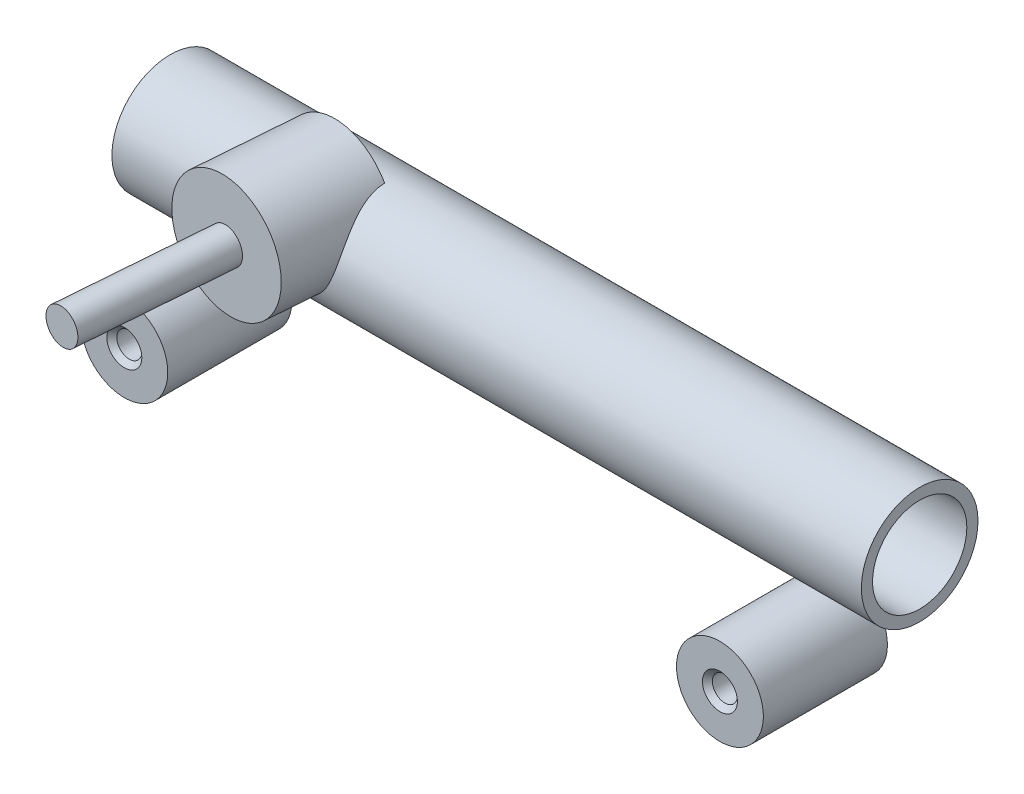
from build123d import *

# Parameters (mm, degrees)
SZKIC1_R                    = 23.5
DODANIE_WYCI_GNI_CIE1_DEPTH = 302
SZKIC2_R                    = 17.5
DODANIE_WYCI_GNI_CIE2_DEPTH = 50
SZKIC4_R                    = 17.5
DODANIE_WYCI_GNI_CIE3_DEPTH = 50
SZKIC5_R                    = 5.05
WYTNIJ_WYCI_GNI_CIE1_DEPTH  = 50
SFAZOWANIE1_SIZE            = 2
SZKIC8_R                    = 24
DODANIE_WYCI_GNI_CIE4_DEPTH = 42.129872
SZKIC12_R                   = 7
DODANIE_WYCI_GNI_CIE5_DEPTH = 61.69017
SZKIC6_R                    = 19
WYTNIJ_WYCI_GNI_CIE2_DEPTH  = 302
DODANIE_WYCI_GNI_CIE6_START = -50
SZKIC13_R                   = 7
DODANIE_WYCI_GNI_CIE6_DEPTH = 50


with BuildPart() as part:
    # Szkic1 → Dodanie-wyciągnięcie1 (new body)
    with BuildSketch(Plane(origin=(0, 0, 0), x_dir=(0, 0, -1), z_dir=(1, 0, 0))):
        Circle(SZKIC1_R)
    extrude(amount=DODANIE_WYCI_GNI_CIE1_DEPTH)

    # Szkic2 → Dodanie-wyciągnięcie2 (add)
    with BuildSketch(Plane.XY):
        with Locations(Location((31.5, -38, 0), (0, 0, 124.04773237))):
            Circle(SZKIC2_R)
    extrude(amount=DODANIE_WYCI_GNI_CIE2_DEPTH)

    # Szkic4 → Dodanie-wyciągnięcie3 (add)
    with BuildSketch(Plane(origin=(0, 0, 0), x_dir=(-1, 0, 0), z_dir=(0, 0, -1))):
        with Locations((-271.5, -38)):
            Circle(SZKIC4_R)
    extrude(amount=-DODANIE_WYCI_GNI_CIE3_DEPTH)

    # Szkic5 → Wytnij-wyciągnięcie1 (cut)
    with BuildSketch(Plane.XY.offset(50)):
        with Locations((31.5, -38)):
            Circle(SZKIC5_R)
        with Locations((271.5, -38)):
            Circle(SZKIC5_R)
    extrude(amount=-WYTNIJ_WYCI_GNI_CIE1_DEPTH, mode=Mode.SUBTRACT)

    # Sfazowanie1
    sfazowanie1_edges = [part.edges().sort_by_distance(p)[0] for p in [
        (26.45, -38, 0),
        (26.45, -38, 50),
        (266.45, -38, 0),
        (266.45, -38, 50),
    ]]
    chamfer(sfazowanie1_edges, length=SFAZOWANIE1_SIZE)

    # Szkic8 → Dodanie-wyciągnięcie4 (add)
    with BuildSketch(Plane(origin=(64.694528313, 23.5, 42), x_dir=(0.9969173337331281, 0, 0.07845909572784458), z_dir=(-0.07845909572784458, 0, 0.9969173337331281))):
        with Locations((0, -13.25)):
            Circle(SZKIC8_R)
    extrude(amount=-DODANIE_WYCI_GNI_CIE4_DEPTH)

    # Szkic12 → Dodanie-wyciągnięcie5 (add)
    with BuildSketch(Plane(origin=(-2.886875267, 0, 36.681228189), x_dir=(0.9969173337331281, 0, 0.07845909572784461), z_dir=(-0.07845909572784461, 0, 0.9969173337331281))):
        with Locations((67.790378694, 10.25)):
            Circle(SZKIC12_R)
    extrude(amount=DODANIE_WYCI_GNI_CIE5_DEPTH)

    # Szkic6 → Wytnij-wyciągnięcie2 (cut)
    with BuildSketch(Plane.ZY):
        Circle(SZKIC6_R)
    extrude(amount=-WYTNIJ_WYCI_GNI_CIE2_DEPTH, mode=Mode.SUBTRACT)

    # Szkic13 → Dodanie-wyciągnięcie6 (add)
    with BuildSketch(Plane(origin=(64.694528313, 23.5, 42), x_dir=(0.9969173337331281, 0, 0.07845909572784458), z_dir=(-0.07845909572784458, 0, 0.9969173337331281)).offset(DODANIE_WYCI_GNI_CIE6_START)):
        with Locations((0, -13.25)):
            Circle(SZKIC13_R)
    extrude(amount=DODANIE_WYCI_GNI_CIE6_DEPTH)


solid = part.part
